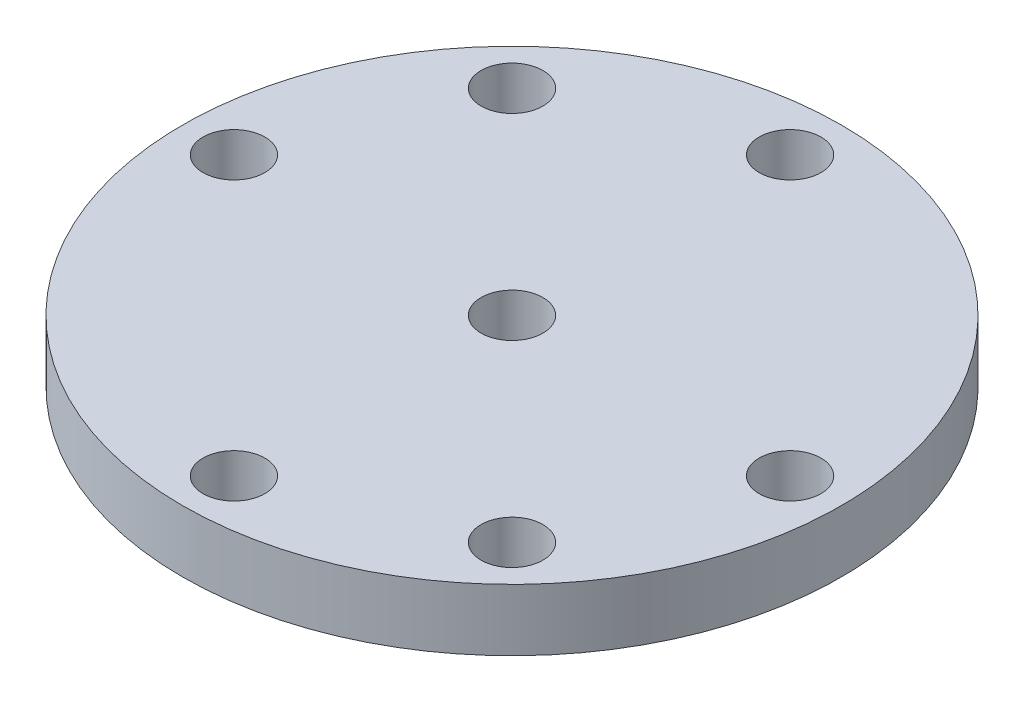
from build123d import *

# Parameters (mm, degrees)
ESBO_O1_R                = 32
ESBO_O1_R_2              = 5
ESBO_O1_R_3              = 3
RESSALTO_EXTRUS_O1_DEPTH = 6
RESSALTO_EXTRUS_O3_START = -6
ESBO_O2_R                = 5
ESBO_O2_R_2              = 3
RESSALTO_EXTRUS_O3_DEPTH = 6


with BuildPart() as part:
    # Esboço1 → Ressalto-extrusão1 (new body)
    with BuildSketch(Plane(origin=(0, 0, 0), x_dir=(1, 0, 0), z_dir=(0, 1, 0))):
        with Locations(Location((0, 0, 0), (0, 0, 270))):
            Circle(ESBO_O1_R)
        with Locations(Location((0, 0, 0), (0, 0, 270))):
            Circle(ESBO_O1_R_2, mode=Mode.SUBTRACT)
        with Locations(Location((0, 27, 0), (0, 0, 270))):
            Circle(ESBO_O1_R_3, mode=Mode.SUBTRACT)
        with Locations(Location((27, 0, 0), (0, 0, 270))):
            Circle(ESBO_O1_R_3, mode=Mode.SUBTRACT)
        with Locations(Location((0, -27, 0), (0, 0, 270))):
            Circle(ESBO_O1_R_3, mode=Mode.SUBTRACT)
        with Locations(Location((-27, 0, 0), (0, 0, 270))):
            Circle(ESBO_O1_R_3, mode=Mode.SUBTRACT)
        with Locations(Location((-19.091883092, 19.091883092, 0), (0, 0, 270))):
            Circle(ESBO_O1_R_3, mode=Mode.SUBTRACT)
        with Locations(Location((19.091883092, -19.091883092, 0), (0, 0, 270))):
            Circle(ESBO_O1_R_3, mode=Mode.SUBTRACT)
    extrude(amount=RESSALTO_EXTRUS_O1_DEPTH)

    # Esboço2 → Ressalto-extrusão3 (add)
    with BuildSketch(Plane(origin=(0, 6, 0), x_dir=(1, 0, 0), z_dir=(0, 1, 0)).offset(RESSALTO_EXTRUS_O3_START)):
        Circle(ESBO_O2_R)
        with Locations(Location((0, 0, 0), (0, 0, 270))):
            Circle(ESBO_O2_R_2, mode=Mode.SUBTRACT)
    extrude(amount=RESSALTO_EXTRUS_O3_DEPTH)


solid = part.part
